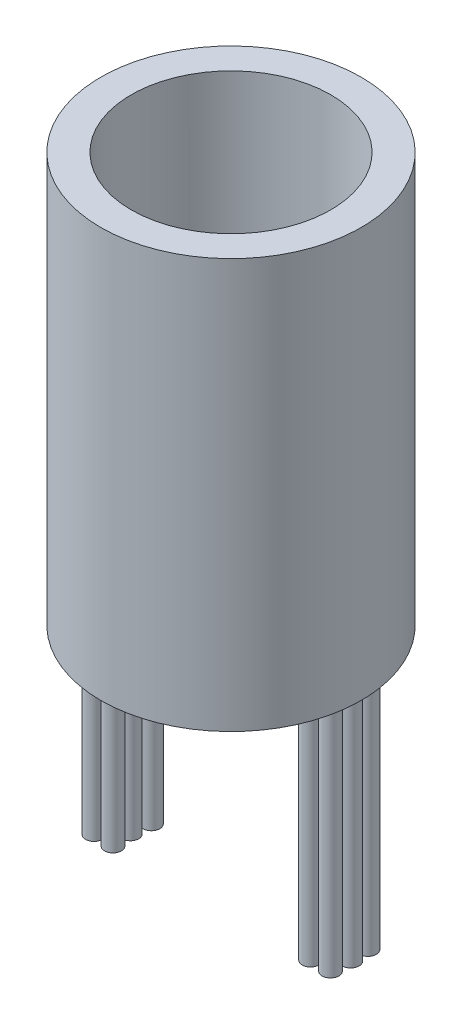
from build123d import *

# Parameters (mm, degrees)
SKETCH1_R               = 6.2
BOSS_EXTRUDE1_DEPTH     = 19.5
SKETCH2_R               = 2
BOSS_EXTRUDE2_DEPTH     = 2.8
SKETCH3_R               = 0.4
BOSS_EXTRUDE4_DEPTH     = 3.5
CUT_EXTRUDE1_START      = -0.2
SKETCH4_R               = 4.75
SKETCH4_R_2             = 2
CUT_EXTRUDE1_DEPTH      = 0.2
SKETCH5_R               = 0.4
BOSS_EXTRUDE5_DEPTH     = 11
CUT_EXTRUDE3_DEPTH      = 32.543145056
CUT_EXTRUDE3_DEPTH_BACK = 19.3
SKETCH6_R               = 4.75


with BuildPart() as part:
    # Sketch1 → Boss-Extrude1 (new body)
    with BuildSketch(Plane(origin=(0, 0, 0), x_dir=(1, 0, 0), z_dir=(0, 1, 0))):
        with Locations(Location((0, 0, 0), (0, 0, 270))):
            Circle(SKETCH1_R)
    extrude(amount=BOSS_EXTRUDE1_DEPTH)

    # Sketch2 → Boss-Extrude2 (add)
    with BuildSketch(Plane(origin=(0, 19.5, 0), x_dir=(1, 0, 0), z_dir=(0, 1, 0))):
        with Locations(Location((0, 0, 0), (0, 0, 270))):
            Circle(SKETCH2_R)
    extrude(amount=BOSS_EXTRUDE2_DEPTH)

    # Sketch3 → Boss-Extrude4 (add)
    with BuildSketch(Plane(origin=(0, 22.3, 0), x_dir=(1, 0, 0), z_dir=(0, 1, 0))):
        with Locations(Location((-0.41145274, -0.237271907, 0), (0, 0, 270))):
            Circle(SKETCH3_R)
        with Locations(Location((-0.09128588, 1.346231062, 0), (0, 0, 270))):
            Circle(SKETCH3_R)
        with Locations(Location((0.706061251, 1.146478436, 0), (0, 0, 270))):
            Circle(SKETCH3_R)
        with Locations(Location((1.233716983, 0.516206281, 0), (0, 0, 270))):
            Circle(SKETCH3_R)
        with Locations(Location((1.29013476, -0.30384286, 0), (0, 0, 270))):
            Circle(SKETCH3_R)
        with Locations(Location((0.853764908, -1.000438089, 0), (0, 0, 270))):
            Circle(SKETCH3_R)
        with Locations(Location((0.09128588, -1.307503705, 0), (0, 0, 270))):
            Circle(SKETCH3_R)
        with Locations(Location((-0.706061251, -1.107751078, 0), (0, 0, 270))):
            Circle(SKETCH3_R)
        with Locations(Location((-1.233716983, -0.477478923, 0), (0, 0, 270))):
            Circle(SKETCH3_R)
        with Locations(Location((-1.29013476, 0.342570218, 0), (0, 0, 270))):
            Circle(SKETCH3_R)
        with Locations(Location((-0.853764908, 1.039165447, 0), (0, 0, 270))):
            Circle(SKETCH3_R)
        with Locations(Location((0, 0.516206281, 0), (0, 0, 270))):
            Circle(SKETCH3_R)
        with Locations(Location((0.441742202, -0.237271907, 0), (0, 0, 270))):
            Circle(SKETCH3_R)
    extrude(amount=BOSS_EXTRUDE4_DEPTH)

    # Sketch4 → Cut-Extrude1 (cut)
    with BuildSketch(Plane(origin=(0, 19.5, 0), x_dir=(1, 0, 0), z_dir=(0, 1, 0)).offset(CUT_EXTRUDE1_START)):
        with Locations(Location((0, 0, 0), (0, 0, 270))):
            Circle(SKETCH4_R)
        with Locations(Location((0, 0, 0), (0, 0, 270))):
            Circle(SKETCH4_R_2, mode=Mode.SUBTRACT)
    extrude(amount=CUT_EXTRUDE1_DEPTH, mode=Mode.SUBTRACT)

    # Sketch5 → Boss-Extrude5 (add)
    with BuildSketch(Plane.XZ):
        with Locations(Location((-5.700120356, 0, 0), (0, 0, 90))):
            Circle(SKETCH5_R)
        with Locations(Location((-5.629942415, 0.891695278, 0), (0, 0, 90))):
            Circle(SKETCH5_R)
        with Locations(Location((-4.791405516, 0, 0), (0, 0, 90))):
            Circle(SKETCH5_R)
        with Locations(Location((-4.703373902, 0.914243273, 0), (0, 0, 90))):
            Circle(SKETCH5_R)
        with Locations(Location((-4.703373902, -0.914243273, 0), (0, 0, 90))):
            Circle(SKETCH5_R)
        with Locations(Location((-5.629942415, -0.891695278, 0), (0, 0, 90))):
            Circle(SKETCH5_R)
        with Locations(Location((5.629942415, -0.891695278, 0), (0, 0, 90))):
            Circle(SKETCH5_R)
        with Locations(Location((4.703373902, -0.914243273, 0), (0, 0, 90))):
            Circle(SKETCH5_R)
        with Locations(Location((4.703373902, 0.914243273, 0), (0, 0, 90))):
            Circle(SKETCH5_R)
        with Locations(Location((4.791405516, 0, 0), (0, 0, 90))):
            Circle(SKETCH5_R)
        with Locations(Location((5.629942415, 0.891695278, 0), (0, 0, 90))):
            Circle(SKETCH5_R)
        with Locations(Location((5.700120356, 0, 0), (0, 0, 90))):
            Circle(SKETCH5_R)
    extrude(amount=BOSS_EXTRUDE5_DEPTH)

    # Sketch6 → Cut-Extrude3 (cut, two sides: drawn at the far end of the back side and taken through both)
    with BuildSketch(Plane(origin=(0, 19.3, 0), x_dir=(1, 0, 0), z_dir=(0, 1, 0)).offset(-CUT_EXTRUDE3_DEPTH_BACK)):
        with Locations(Location((0, 0, 0), (0, 0, 270))):
            Circle(SKETCH6_R)
    extrude(amount=CUT_EXTRUDE3_DEPTH + CUT_EXTRUDE3_DEPTH_BACK, mode=Mode.SUBTRACT)


solid = part.part
